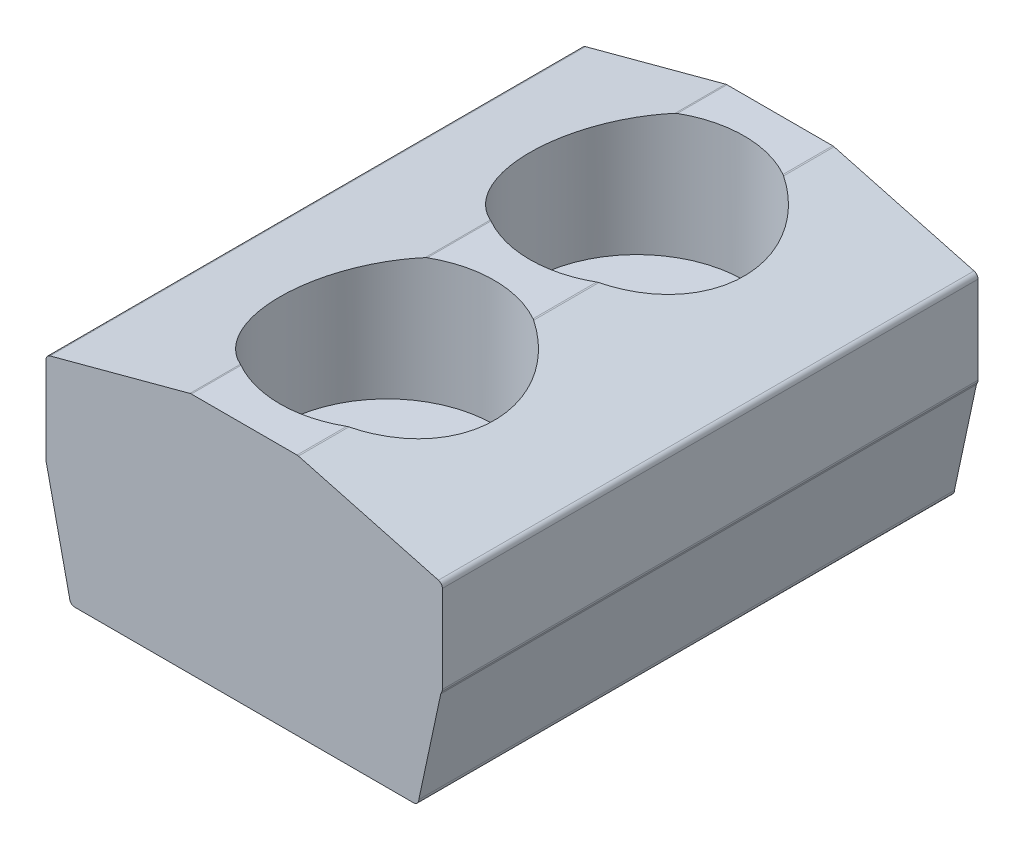
from build123d import *

# Parameters (mm, degrees)
BOSS_EXTRUDE1_DEPTH = 30
SKETCH2_R           = 3.2
CUT_EXTRUDE3_DEPTH  = 37.096941552
SKETCH4_R           = 6
CUT_EXTRUDE4_DEPTH  = 7


with BuildPart() as part:
    # Sketch1 → Boss-Extrude1 (new body)
    with BuildSketch(Plane.XY):
        with BuildLine():
            Line((-5.607917396, 9.03308876), (-1.173065904, 10.221403636))
            Line((-1.173065904, 10.221403636), (0.621358385, 10.702218175))
            ThreePointArc((0.621358385, 10.702218175), (0.659846241, 10.709873886), (0.699004099, 10.712440427))
            Line((0.699004099, 10.712440427), (6.6200126, 10.712440427))
            ThreePointArc((6.6200126, 10.712440427), (6.659170458, 10.709873886), (6.697658314, 10.702218175))
            Line((6.697658314, 10.702218175), (8.492082604, 10.221403636))
            Line((8.492082604, 10.221403636), (12.926934096, 9.03308876))
            Line((12.926934096, 9.03308876), (14.537154063, 8.60163162))
            ThreePointArc((14.537154063, 8.60163162), (14.697514352, 8.494482301), (14.75950835, 8.311853872))
            Line((14.75950835, 8.311853872), (14.75950835, 3.414909596))
            ThreePointArc((14.75950835, 3.414909596), (14.752913122, 3.352350508), (14.73341742, 3.29254203))
            Line((14.73341742, 3.29254203), (14.669480377, 3.149424564))
            Line((14.669480377, 3.149424564), (13.439893107, -2.594399862))
            ThreePointArc((13.439893107, -2.594399862), (13.352025142, -2.806531896), (13.139893107, -2.894399862))
            Line((13.139893107, -2.894399862), (-5.820876408, -2.894399862))
            ThreePointArc((-5.820876408, -2.894399862), (-6.033008442, -2.806531896), (-6.120876408, -2.594399862))
            Line((-6.120876408, -2.594399862), (-7.41440072, 3.29254203))
            ThreePointArc((-7.41440072, 3.29254203), (-7.433896423, 3.352350508), (-7.44049165, 3.414909596))
            Line((-7.44049165, 3.414909596), (-7.44049165, 8.311853872))
            ThreePointArc((-7.44049165, 8.311853872), (-7.378497652, 8.494482301), (-7.218137364, 8.60163162))
            Line((-7.218137364, 8.60163162), (-5.607917396, 9.03308876))
        make_face()
    extrude(amount=BOSS_EXTRUDE1_DEPTH)

    # Sketch2 → Cut-Extrude3 (cut, through all)
    with BuildSketch(Plane.XZ.offset(2.894399862)):
        with Locations((3.65950835, 22)):
            Circle(SKETCH2_R)
        with Locations((3.65950835, 8)):
            Circle(SKETCH2_R)
    extrude(amount=-CUT_EXTRUDE3_DEPTH, mode=Mode.SUBTRACT)

    # Sketch4 → Cut-Extrude4 (cut)
    with BuildSketch(Plane(origin=(0, 10.712440427, 0), x_dir=(1, 0, 0), z_dir=(0, 1, 0))):
        with Locations(Location((3.65950835, -8, 0), (0, 0, 270))):
            Circle(SKETCH4_R)
        with Locations(Location((3.65950835, -22, 0), (0, 0, 270))):
            Circle(SKETCH4_R)
    extrude(amount=-CUT_EXTRUDE4_DEPTH, mode=Mode.SUBTRACT)


solid = part.part
